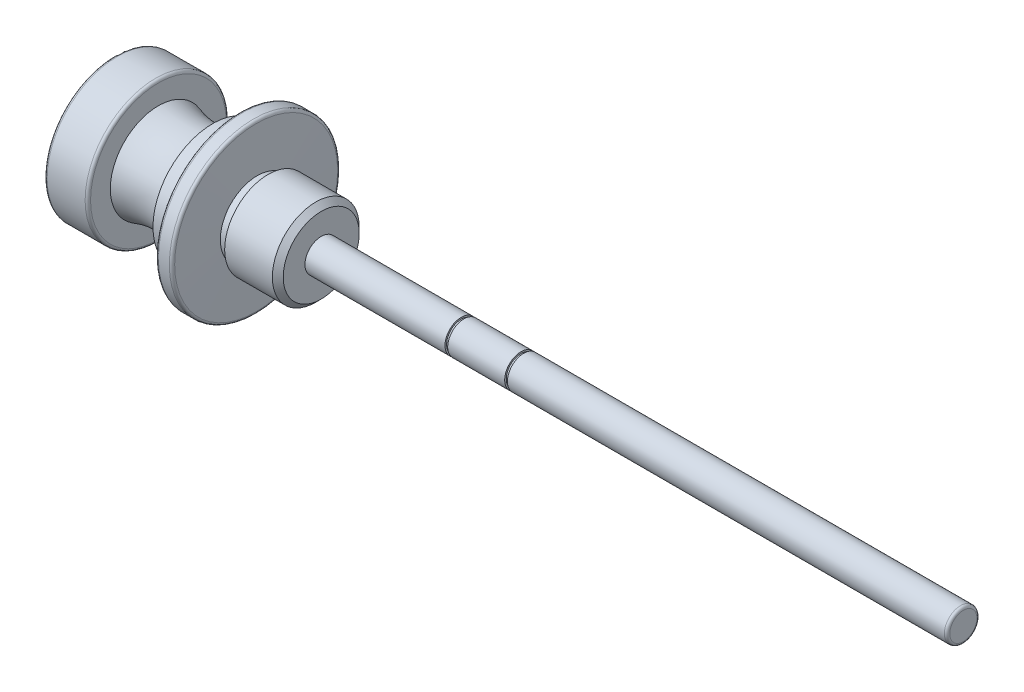
from build123d import *

# Parameters (mm, degrees)
CHAMFER_1_SIZE      = 1
CUT_EXTRUDE_START   = -0.5
SKETCH_2_R          = 3
SKETCH_2_R_2        = 2.7
CUT_EXTRUDE_1_DEPTH = 0.5
SKETCH_3_R          = 3
SKETCH_3_R_2        = 2.7
CUT_EXTRUDE_2_DEPTH = 0.5
FILLET_1_R          = 0.5


with BuildPart() as part:
    # Sketch 1 → 旋转1 (revolve)
    with BuildSketch(Plane.XY, mode=Mode.PRIVATE) as revolve_1_sk:
        with BuildLine():
            Line((0, 11), (0, 8.857864376))
            ThreePointArc((0, 8.857864376), (-5, 8), (-10, 8.857864376))
            Line((-10, 8.857864376), (-10, 13))
            Line((-10, 13), (-18, 13))
            Line((-18, 13), (-18, 2))
            ThreePointArc((-18, 2), (-19.414213562, 1.414213562), (-20, 0))
            Line((-20, 0), (-18, 0))
            Line((-18, 0), (-10, 0))
            Line((-10, 0), (0, 0))
            Line((0, 0), (20, 0))
            Line((20, 0), (138.300668613, 0))
            Line((138.300668613, 0), (138.300668613, 3))
            Line((138.300668613, 3), (20, 3))
            Line((20, 3), (20, 8))
            Line((20, 8), (10.209265355, 8))
            Line((10.209265355, 8), (10.209265355, 6.8))
            Line((10.209265355, 6.8), (8.209265355, 6.8))
            Line((8.209265355, 6.8), (8, 15.5))
            Line((8, 15.5), (5, 15.5))
            Line((5, 15.5), (5, 11))
            Line((5, 11), (0, 11))
        make_face()
    revolve(revolve_1_sk.sketch.rotate(Axis((0, 0, 0), (1, 0, 0)), 90), axis=Axis((0, 0, 0), (1, 0, 0)))

    # 倒角1
    chamfer_1_edges = [part.edges().sort_by_distance(p)[0] for p in [
        (20, 0, -8),
    ]]
    chamfer(chamfer_1_edges, length=CHAMFER_1_SIZE)

    # Sketch 2 → 切除-拉伸1 (cut)
    with BuildSketch(Plane(origin=(57.300668613, 0, 0), x_dir=(0, 0, -1), z_dir=(1, 0, 0)).offset(CUT_EXTRUDE_START)):
        with Locations(Location((0, 0, 0), (0, 0, 180))):
            Circle(SKETCH_2_R)
        Circle(SKETCH_2_R_2, mode=Mode.SUBTRACT)
    extrude(amount=CUT_EXTRUDE_1_DEPTH, mode=Mode.SUBTRACT)

    # 草图3 → 切除-拉伸2 (cut)
    with BuildSketch(Plane(origin=(46.300668613, 0, 0), x_dir=(0, 0, -1), z_dir=(1, 0, 0)).offset(CUT_EXTRUDE_START)):
        with Locations(Location((0, 0, 0), (0, 0, 180))):
            Circle(SKETCH_3_R)
        Circle(SKETCH_3_R_2, mode=Mode.SUBTRACT)
    extrude(amount=CUT_EXTRUDE_2_DEPTH, mode=Mode.SUBTRACT)

    # 圆角1
    fillet_1_edges = [part.edges().sort_by_distance(p)[0] for p in [
        (138.300668613, 0, -3),
        (-18, 0, -13),
        (-10, 0, -13),
        (5, 0, -15.5),
        (8, 0, -15.5),
    ]]
    fillet(fillet_1_edges, radius=FILLET_1_R)


solid = part.part
